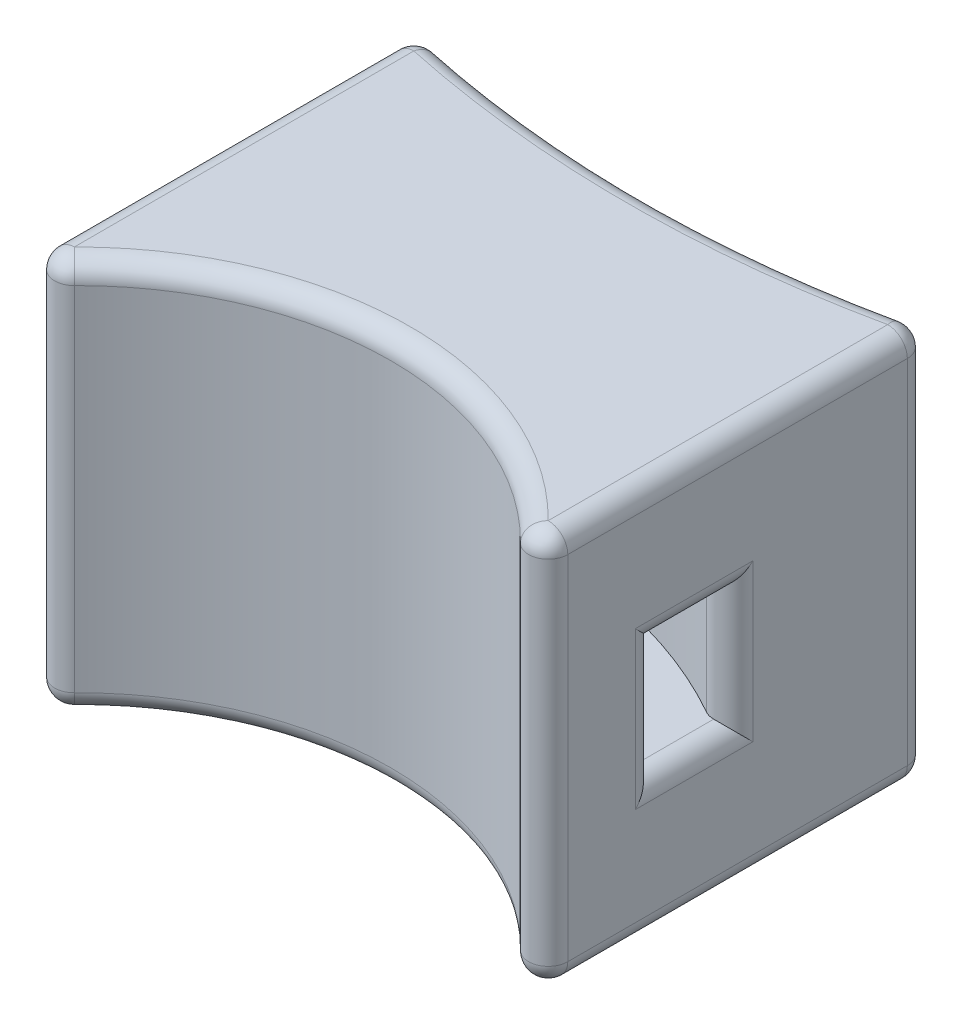
from build123d import *

# Parameters (mm, degrees)
BOSS_EXTRUDE1_DEPTH = 20
SKETCH2_W           = 3
SKETCH2_H           = 6
FILLET1_R           = 1


with BuildPart() as part:
    # Sketch1 → Boss-Extrude1 (new body)
    with BuildSketch(Plane(origin=(0, 0, 0), x_dir=(1, 0, 0), z_dir=(0, 1, 0))):
        with BuildLine():
            Line((-13.097063825, 30.526339541), (-13.097063825, 9.190588619))
            ThreePointArc((-13.097063825, 9.190588619), (0, 16), (13.097063825, 9.190588619))
            Line((13.097063825, 9.190588619), (13.097063825, 30.526339541))
            ThreePointArc((13.097063825, 30.526339541), (0, 29), (-13.097063825, 30.526339541))
        make_face()
    extrude(amount=BOSS_EXTRUDE1_DEPTH)

    # Sketch2 → Cut-Revolve1 (revolve, cut)
    with BuildSketch(Plane(origin=(0, 0, 0), x_dir=(0, 0, -1), z_dir=(1, 0, 0))):
        with Locations((22.074416819, 10)):
            Rectangle(SKETCH2_W, SKETCH2_H)
    revolve(axis=Axis((0, 0, 0), (0, 1, 0)), mode=Mode.SUBTRACT)

    # Fillet1
    fillet1_edges = [part.edges().sort_by_distance(p)[0] for p in [
        (0, 20, -16),
        (13.097063825, 13, -17.734452708),
        (13.097063825, 10, -19.601531765),
        (13.097063825, 7, -17.734452708),
        (13.097063825, 10, -15.867373652),
        (13.097063825, 20, -19.85846408),
        (-13.097063825, 10, -15.867373652),
        (-13.097063825, 7, -17.734452708),
        (-13.097063825, 10, -19.601531765),
        (-13.097063825, 13, -17.734452708),
        (0, 20, -29),
        (13.097063825, 0, -19.85846408),
        (0, 0, -16),
        (-13.097063825, 0, -19.85846408),
        (0, 0, -29),
        (13.097063825, 10, -30.526339541),
        (13.097063825, 10, -9.190588619),
        (-13.097063825, 10, -9.190588619),
        (-13.097063825, 10, -30.526339541),
        (-13.097063825, 20, -19.85846408),
    ]]
    fillet(fillet1_edges, radius=FILLET1_R)


solid = part.part
